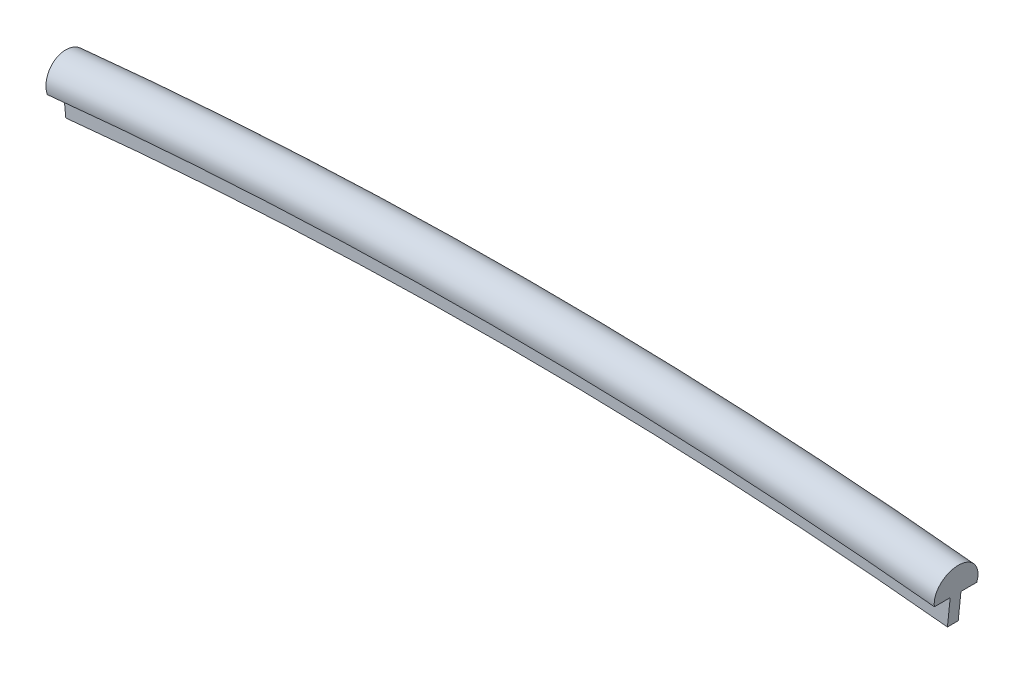
from build123d import *

# Parameters (mm, degrees)
REVOLVE1_ANGLE           = 5.876799589
REVOLVE1_OTHER_WAY_ANGLE = 5.876799589


with BuildPart() as part:
    # Sketch2 → Revolve1 (revolve)
    with BuildSketch(Plane(origin=(0, 0, 0), x_dir=(0, 0, -1), z_dir=(1, 0, 0))):
        with BuildLine():
            Line((0, 239.8), (0.3, 239.8))
            Line((0.3, 239.8), (0.3, 241.3))
            Line((0.3, 241.3), (1.18, 241.3))
            ThreePointArc((1.18, 241.3), (0, 242.800182019), (-1.18, 241.3))
            Line((-1.18, 241.3), (-0.3, 241.3))
            Line((-0.3, 241.3), (-0.3, 239.8))
            Line((-0.3, 239.8), (0, 239.8))
        make_face()
    revolve(axis=Axis((0, 0, 70.597641597), (0, 0, -1)), revolution_arc=REVOLVE1_ANGLE)

    # Sketch2 → Revolve1 other way (revolve)
    with BuildSketch(Plane(origin=(0, 0, 0), x_dir=(0, 0, -1), z_dir=(1, 0, 0))):
        with BuildLine():
            Line((0, 239.8), (0.3, 239.8))
            Line((0.3, 239.8), (0.3, 241.3))
            Line((0.3, 241.3), (1.18, 241.3))
            ThreePointArc((1.18, 241.3), (0, 242.800182019), (-1.18, 241.3))
            Line((-1.18, 241.3), (-0.3, 241.3))
            Line((-0.3, 241.3), (-0.3, 239.8))
            Line((-0.3, 239.8), (0, 239.8))
        make_face()
    revolve(axis=Axis((0, 0, 70.597641597), (0, 0, 1)), revolution_arc=REVOLVE1_OTHER_WAY_ANGLE)


solid = part.part
